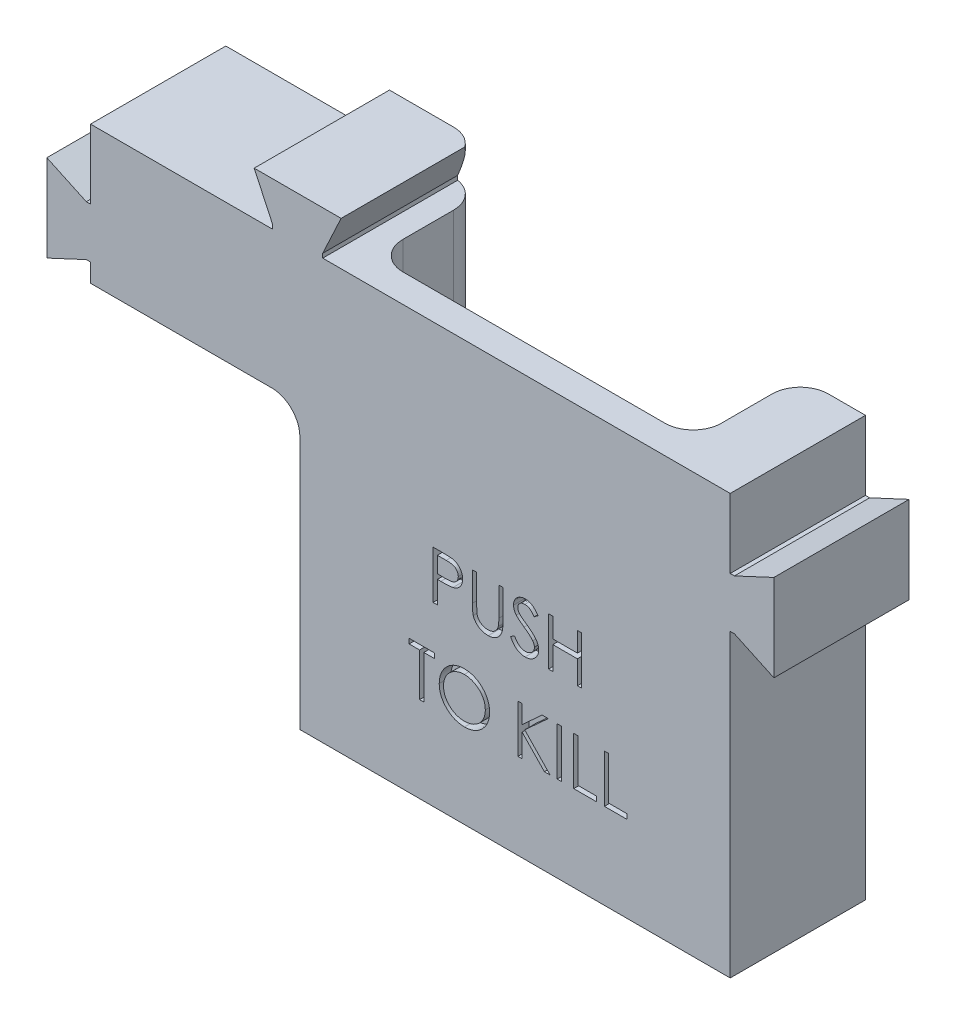
from build123d import *

# Parameters (mm, degrees)
BOSS_EXTRUDE1_DEPTH = 12.192
SKETCH2_W           = 28.702
SKETCH2_H           = 9.652
CUT_EXTRUDE1_DEPTH  = 70.581005453
FILLET1_R           = 2.54
BOSS_EXTRUDE2_DEPTH = 25.4
FILLET2_R           = 2.54
SKETCH4_W           = 0.387512821
SKETCH4_H           = 4.318
CUT_EXTRUDE2_DEPTH  = 1.016


with BuildPart() as part:
    # Sketch1 → Boss-Extrude1 (new body)
    with BuildSketch(Plane.XY):
        Polygon((4.926373889, 102.842156817), (21.33563188, 102.842156817), (21.33563188, 103.223156817), (19.677441848, 106.779156817), (27.51330593, 106.779156817), (25.855115898, 103.223156817), (25.855115898, 102.842156817), (62.584373889, 102.842156817), (62.584373889, 96.592898826), (62.965373889, 96.592898826), (66.521373889, 98.251088858), (66.521373889, 90.415224777), (62.965373889, 92.073414809), (62.584373889, 92.073414809), (62.584373889, 90.415224777), (4.926373889, 90.415224777), (4.926373889, 92.073414809), (4.545373889, 92.073414809), (0.989373889, 90.415224777), (0.989373889, 98.251088858), (4.545373889, 96.592898826), (4.926373889, 96.592898826), align=None)
    extrude(amount=BOSS_EXTRUDE1_DEPTH)

    # Sketch2 → Cut-Extrude1 (cut, through all)
    with BuildSketch(Plane.XZ.offset(-90.415224777)):
        with Locations((42.3545, 4.826)):
            Rectangle(SKETCH2_W, SKETCH2_H)
    extrude(amount=-CUT_EXTRUDE1_DEPTH, mode=Mode.SUBTRACT)

    # Fillet1
    fillet1_edges = [part.edges().sort_by_distance(p)[0] for p in [
        (56.7055, 96.628690797, 0),
        (28.0035, 96.628690797, 0),
        (28.0035, 96.628690797, 9.652),
        (56.7055, 96.628690797, 9.652),
    ]]
    fillet(fillet1_edges, radius=FILLET1_R)

    # Sketch3 → Boss-Extrude2 (add)
    with BuildSketch(Plane.XZ.offset(-90.415224777)):
        with BuildLine():
            Line((23.793902063, 12.192), (23.793902063, 0))
            Line((23.793902063, 0), (25.4635, 0))
            ThreePointArc((25.4635, 0), (27.259551224, 0.743948776), (28.0035, 2.54))
            Line((28.0035, 2.54), (28.0035, 7.112))
            ThreePointArc((28.0035, 7.112), (28.747448776, 8.908051224), (30.5435, 9.652))
            Line((30.5435, 9.652), (54.1655, 9.652))
            ThreePointArc((54.1655, 9.652), (55.961551224, 8.908051224), (56.7055, 7.112))
            Line((56.7055, 7.112), (56.7055, 2.54))
            ThreePointArc((56.7055, 2.54), (57.449448776, 0.743948776), (59.2455, 0))
            Line((59.2455, 0), (62.584373889, 0))
            Line((62.584373889, 0), (62.584373889, 12.192))
            Line((62.584373889, 12.192), (23.793902063, 12.192))
        make_face()
    extrude(amount=BOSS_EXTRUDE2_DEPTH)

    # Fillet2
    fillet2_edges = [part.edges().sort_by_distance(p)[0] for p in [
        (23.793902063, 90.415224777, 6.096),
    ]]
    fillet(fillet2_edges, radius=FILLET2_R)

    # Sketch4 → Cut-Extrude2 (cut)
    # profile 1 of 10: a face of its own
    with BuildSketch(Plane.XY.offset(12.192)):
        with BuildLine():
            Line((35.803091039, 85.260556175), (36.64991035, 85.260556175))
            add(Edge.make_bspline(
                [(36.64991035, 85.260556175), (36.708155119, 85.26049215), (36.819754684, 85.260369475), (36.979786001, 85.25665014), (37.12512955, 85.251682352), (37.255471934, 85.244795891), (37.371214195, 85.236657583), (37.4718326, 85.22524321), (37.55811803, 85.213325166), (37.609818615, 85.201208356), (37.633397129, 85.195682377)],
                knots=[0, 0, 0, 0, 1.415646017, 2.712440637, 3.8905458, 4.950247383, 5.884950622, 6.709939814, 7.411656543, 8, 8, 8, 8], degree=3))
            add(Edge.make_bspline(
                [(37.633397129, 85.195682377), (37.663245037, 85.187512783), (37.722237525, 85.171366101), (37.807241726, 85.139025856), (37.888116442, 85.100679345), (37.965139147, 85.056976324), (38.037363351, 85.006041734), (38.105866621, 84.949940282), (38.170044414, 84.887376695), (38.229535834, 84.819052685), (38.284170622, 84.746115238), (38.331211756, 84.667475538), (38.370600832, 84.584457296), (38.404383965, 84.497118256), (38.428698567, 84.404724994), (38.447015399, 84.30791949), (38.458641463, 84.20671212), (38.459754967, 84.137550261), (38.460321808, 84.102342633)],
                knots=[0, 0, 0, 0, 0.999701418, 1.975846123, 2.934577507, 3.890451536, 4.834027766, 5.787354733, 6.749476667, 7.726910423, 8.712836071, 9.690891519, 10.682875813, 11.679750201, 12.712814741, 13.765529915, 14.8625177, 16, 16, 16, 16], degree=3))
            add(Edge.make_bspline(
                [(38.460321808, 84.102342633), (38.45980189, 84.066839079), (38.458784636, 83.997373977), (38.446575448, 83.895749491), (38.4301298, 83.798633489), (38.404842294, 83.706241304), (38.371722403, 83.619121619), (38.332870208, 83.535943082), (38.286009384, 83.45812079), (38.232164134, 83.385372215), (38.172265338, 83.317629071), (38.106566428, 83.255382271), (38.035332638, 83.198996175), (37.958790353, 83.148344378), (37.876193368, 83.104601459), (37.788794391, 83.065422018), (37.695833753, 83.03251755), (37.631504789, 83.015208463), (37.59879777, 83.006407938)],
                knots=[0, 0, 0, 0, 1.121902311, 2.195077645, 3.232258892, 4.234102512, 5.217864754, 6.176164875, 7.132989551, 8.084763148, 9.034132444, 9.988522005, 10.94243251, 11.903244335, 12.886203696, 13.894208494, 14.929344452, 16, 16, 16, 16], degree=3))
            add(Edge.make_bspline(
                [(37.59879777, 83.006407938), (37.571745705, 83.000655151), (37.512459531, 82.988047586), (37.414820024, 82.973972809), (37.301138945, 82.961959392), (37.171571458, 82.952951875), (37.026233864, 82.945240706), (36.865047541, 82.939111497), (36.687696082, 82.935743638), (36.563990016, 82.93556994), (36.499403138, 82.935479252)],
                knots=[0, 0, 0, 0, 0.601384939, 1.31797006, 2.144135048, 3.087295005, 4.142315834, 5.309527816, 6.595305764, 8, 8, 8, 8], degree=3))
            Line((36.499403138, 82.935479252), (36.190603859, 82.935479252))
            Line((36.190603859, 82.935479252), (36.190603859, 80.942556175))
            Line((36.190603859, 80.942556175), (35.803091039, 80.942556175))
            Line((35.803091039, 80.942556175), (35.803091039, 85.260556175))
        make_face()
        with BuildLine():
            Line((36.190603859, 84.81768438), (36.190603859, 83.378351047))
            Line((36.190603859, 83.378351047), (36.946599853, 83.368836223))
            add(Edge.make_bspline(
                [(36.946599853, 83.368836223), (36.983512493, 83.368817145), (37.054771583, 83.368780316), (37.157708044, 83.373696944), (37.253208987, 83.379372686), (37.340981066, 83.387682891), (37.421063847, 83.399429403), (37.493590861, 83.411287541), (37.557999732, 83.428442786), (37.63337869, 83.451541704), (37.717374089, 83.490937428), (37.808752281, 83.548119949), (37.88619325, 83.621008663), (37.953206509, 83.702961627), (38.006386847, 83.794132039), (38.045317925, 83.891680516), (38.068192416, 83.994606646), (38.071259668, 84.065037098), (38.072808988, 84.100612665)],
                knots=[0, 0, 0, 0, 1.160613943, 2.240541288, 3.23993089, 4.169200891, 5.011653406, 5.7853311, 6.478053781, 7.106038997, 8.262395093, 9.384106736, 10.481365981, 11.59014053, 12.70357646, 13.786202915, 14.881775077, 16, 16, 16, 16], degree=3))
            add(Edge.make_bspline(
                [(38.072808988, 84.100612665), (38.071251243, 84.135327551), (38.068154638, 84.204336448), (38.045138633, 84.305474816), (38.006462537, 84.401995323), (37.952849516, 84.49202326), (37.88778203, 84.573681333), (37.812156155, 84.64461636), (37.726149908, 84.701640735), (37.646145719, 84.738446481), (37.575082313, 84.760918927), (37.51335717, 84.776642418), (37.443663818, 84.789196209), (37.365979568, 84.799361402), (37.280906537, 84.808063357), (37.187713839, 84.813967886), (37.086754504, 84.817424082), (37.016666492, 84.817595514), (36.980334228, 84.81768438)],
                knots=[0, 0, 0, 0, 1.120700087, 2.227813068, 3.331159281, 4.466773991, 5.599788987, 6.693661531, 7.80175334, 8.91857717, 9.525282508, 10.207424825, 10.974604443, 11.810962634, 12.737642355, 13.736264703, 14.826523623, 16, 16, 16, 16], degree=3))
            Line((36.980334228, 84.81768438), (36.190603859, 84.81768438))
        make_face(mode=Mode.SUBTRACT)
    # profile 2 of 10: a face of its own
    with BuildSketch(Plane.XY.offset(12.192)):
        with BuildLine():
            Line((39.346065398, 85.260556175), (39.733578218, 85.260556175))
            Line((39.733578218, 85.260556175), (39.733578218, 82.673389108))
            add(Edge.make_bspline(
                [(39.733578218, 82.673389108), (39.73352055, 82.63677156), (39.733411113, 82.567283453), (39.734142106, 82.468378675), (39.736189293, 82.380448824), (39.737479955, 82.303154962), (39.740351219, 82.236851767), (39.742692867, 82.181180026), (39.745703817, 82.13640335), (39.749322446, 82.110272139), (39.750877898, 82.099039749)],
                knots=[0, 0, 0, 0, 1.528628734, 2.90083645, 4.128790002, 5.200304208, 6.127813768, 6.898992206, 7.526736466, 8, 8, 8, 8], degree=3))
            add(Edge.make_bspline(
                [(39.750877898, 82.099039749), (39.757265403, 82.058516228), (39.7696805, 81.979752541), (39.801320802, 81.867597695), (39.845509365, 81.766517684), (39.897871953, 81.673358325), (39.966876815, 81.590712595), (40.049540033, 81.514578047), (40.149690206, 81.447992261), (40.261046005, 81.387107459), (40.381068192, 81.338172081), (40.503713291, 81.301168839), (40.627137744, 81.278617899), (40.709767196, 81.276006694), (40.750799372, 81.274710021)],
                knots=[0, 0, 0, 0, 1.035780045, 2.013197591, 2.933192213, 3.817615948, 4.702609284, 5.640816605, 6.646850145, 7.73207398, 8.84249596, 9.914020372, 10.964143139, 12, 12, 12, 12], degree=3))
            add(Edge.make_bspline(
                [(40.750799372, 81.274710021), (40.78602653, 81.276034846), (40.856277382, 81.278676843), (40.960657544, 81.29503766), (41.062315735, 81.324524129), (41.161753945, 81.362571579), (41.254962274, 81.412842465), (41.341992726, 81.470914432), (41.419672232, 81.539028878), (41.490558984, 81.614409246), (41.552287799, 81.699461262), (41.605795396, 81.792332976), (41.649624243, 81.894422028), (41.671267941, 81.966167969), (41.682387113, 82.003026528)],
                knots=[0, 0, 0, 0, 0.994687771, 1.983630487, 2.973142513, 3.978332533, 4.983357753, 5.956394766, 6.925816176, 7.893390482, 8.871859704, 9.88551698, 10.913711441, 12, 12, 12, 12], degree=3))
            add(Edge.make_bspline(
                [(41.682387113, 82.003026528), (41.68608841, 82.01826114), (41.694336392, 82.052209996), (41.702043461, 82.109603977), (41.710070654, 82.17732177), (41.715640344, 82.25584992), (41.721070192, 82.344925292), (41.724318652, 82.445011915), (41.725820123, 82.555746359), (41.726267567, 82.633022721), (41.726501295, 82.673389108)],
                knots=[0, 0, 0, 0, 0.558680831, 1.244966039, 2.062412453, 2.990489873, 4.051219941, 5.244515665, 6.560634259, 8, 8, 8, 8], degree=3))
            Line((41.726501295, 82.673389108), (41.726501295, 85.260556175))
            Line((41.726501295, 85.260556175), (42.114014116, 85.260556175))
            Line((42.114014116, 85.260556175), (42.114014116, 82.652629492))
            add(Edge.make_bspline(
                [(42.114014116, 82.652629492), (42.113700604, 82.605626978), (42.113088766, 82.513898713), (42.107783084, 82.379483865), (42.099323505, 82.251975816), (42.087371172, 82.131357425), (42.071533978, 82.018060311), (42.053922435, 81.9110914), (42.031494085, 81.811218536), (42.005298135, 81.717662999), (41.975351512, 81.6286067), (41.936562118, 81.544086643), (41.892858406, 81.461533393), (41.841024329, 81.38219556), (41.782778972, 81.305721864), (41.716834869, 81.232576085), (41.645373005, 81.161589342), (41.567205411, 81.094582536), (41.48362062, 81.03313286), (41.394867266, 80.979098924), (41.301627126, 80.933422358), (41.204142569, 80.895823775), (41.102371993, 80.867553707), (40.996312833, 80.846487843), (40.88572368, 80.83451798), (40.810510713, 80.83273905), (40.772423972, 80.831838226)],
                knots=[0, 0, 0, 0, 1.316592851, 2.569410997, 3.76748051, 4.895814652, 5.963796859, 6.97159953, 7.931736103, 8.829262218, 9.692595152, 10.560224239, 11.431080259, 12.30701507, 13.211635791, 14.121146779, 15.063487852, 16.031507147, 17.00238618, 17.966455255, 18.938106653, 19.907068911, 20.888905087, 21.893141452, 22.933117798, 24, 24, 24, 24], degree=3))
            add(Edge.make_bspline(
                [(40.772423972, 80.831838226), (40.730885919, 80.832806402), (40.649388408, 80.83470596), (40.529301043, 80.845590713), (40.414177986, 80.866093064), (40.302803347, 80.892198389), (40.196693436, 80.928202782), (40.094426609, 80.970270126), (39.997754385, 81.0219347), (39.905108452, 81.079417635), (39.818964653, 81.14409466), (39.739886771, 81.214589309), (39.667744254, 81.289772323), (39.603753102, 81.370457689), (39.546853108, 81.45601788), (39.497837376, 81.546694942), (39.45575138, 81.642453768), (39.434029906, 81.709016602), (39.423048972, 81.742666351)],
                knots=[0, 0, 0, 0, 1.13879206, 2.234305948, 3.301075583, 4.341971843, 5.366689343, 6.369221514, 7.369726634, 8.367512178, 9.355451585, 10.318319045, 11.268648973, 12.207971039, 13.137398894, 14.081662264, 15.030215811, 16, 16, 16, 16], degree=3))
            add(Edge.make_bspline(
                [(39.423048972, 81.742666351), (39.416661838, 81.765653625), (39.402808002, 81.815513532), (39.38797222, 81.898032349), (39.375500502, 81.993046753), (39.363773359, 82.100563248), (39.356853507, 82.220665169), (39.350786793, 82.353300455), (39.346022659, 82.498629483), (39.346050753, 82.599861311), (39.346065398, 82.652629492)],
                knots=[0, 0, 0, 0, 0.625038921, 1.35572334, 2.194682327, 3.136881307, 4.189498639, 5.346923369, 6.617055217, 8, 8, 8, 8], degree=3))
            Line((39.346065398, 82.652629492), (39.346065398, 85.260556175))
        make_face()
    # profile 3 of 10: a face of its own
    with BuildSketch(Plane.XY.offset(12.192)):
        with BuildLine():
            Line((42.778321808, 81.775535742), (43.143345045, 81.994376688))
            add(Edge.make_bspline(
                [(43.143345045, 81.994376688), (43.177294688, 81.937546398), (43.242340892, 81.828661756), (43.350847741, 81.681531408), (43.463279715, 81.556479467), (43.580469413, 81.454233412), (43.701701517, 81.373734929), (43.827767444, 81.316734575), (43.958242366, 81.281183895), (44.047037497, 81.276865788), (44.091367481, 81.274710021)],
                knots=[0, 0, 0, 0, 1.272034388, 2.437168799, 3.508375237, 4.49857839, 5.41946034, 6.295179144, 7.148887113, 8, 8, 8, 8], degree=3))
            add(Edge.make_bspline(
                [(44.091367481, 81.274710021), (44.129226299, 81.275764443), (44.204281495, 81.277854836), (44.314775714, 81.297940694), (44.422086406, 81.328798515), (44.524001863, 81.37299131), (44.619115824, 81.426458619), (44.702523169, 81.491038846), (44.774628974, 81.563342159), (44.833611762, 81.644005674), (44.878864445, 81.730756945), (44.913645403, 81.819801447), (44.932946954, 81.912537984), (44.935854514, 81.974976835), (44.937321808, 82.006486463)],
                knots=[0, 0, 0, 0, 1.095163259, 2.171163733, 3.241058638, 4.321873601, 5.38011039, 6.391990106, 7.366004449, 8.327778327, 9.272591725, 10.192022065, 11.087607919, 12, 12, 12, 12], degree=3))
            add(Edge.make_bspline(
                [(44.937321808, 82.006486463), (44.93550293, 82.042437946), (44.931805416, 82.115522057), (44.900553608, 82.223348257), (44.851391023, 82.330055376), (44.806036424, 82.396060652), (44.782489677, 82.430328611)],
                knots=[0, 0, 0, 0, 0.938893495, 1.908633276, 2.914225137, 4, 4, 4, 4], degree=3))
            add(Edge.make_bspline(
                [(44.782489677, 82.430328611), (44.763156616, 82.455060664), (44.722569274, 82.506982514), (44.652793463, 82.584268836), (44.570916639, 82.663989503), (44.479740768, 82.749188648), (44.375944574, 82.835903707), (44.262779029, 82.928269771), (44.137354874, 83.022774231), (44.049391667, 83.086153299), (44.0040041, 83.118855854)],
                knots=[0, 0, 0, 0, 0.722233717, 1.516239348, 2.393582979, 3.351407094, 4.387010283, 5.505090956, 6.712668013, 8, 8, 8, 8], degree=3))
            add(Edge.make_bspline(
                [(44.0040041, 83.118855854), (43.95857381, 83.151214438), (43.871714554, 83.213081585), (43.750244795, 83.304899887), (43.641623083, 83.388846581), (43.546332205, 83.465711931), (43.464414074, 83.535506362), (43.395223168, 83.597559648), (43.340522057, 83.653549995), (43.310104115, 83.689872199), (43.296447209, 83.706179973)],
                knots=[0, 0, 0, 0, 1.452282411, 2.77665338, 3.964542531, 5.026858415, 5.96415736, 6.766646006, 7.446254459, 8, 8, 8, 8], degree=3))
            add(Edge.make_bspline(
                [(43.296447209, 83.706179973), (43.277358509, 83.731595767), (43.239818018, 83.781579335), (43.190264643, 83.859704117), (43.148146671, 83.939677506), (43.115129599, 84.021714404), (43.087326344, 84.104663096), (43.068625788, 84.189605861), (43.056916116, 84.276161551), (43.055716963, 84.334409521), (43.05511668, 84.363567794)],
                knots=[0, 0, 0, 0, 1.068054152, 2.10047183, 3.106115577, 4.101338837, 5.06977816, 6.043150881, 7.020423561, 8, 8, 8, 8], degree=3))
            add(Edge.make_bspline(
                [(43.05511668, 84.363567794), (43.056726935, 84.409251955), (43.059913027, 84.499643812), (43.086857985, 84.631689277), (43.129387686, 84.75775812), (43.188969779, 84.876602228), (43.265777565, 84.985127116), (43.354661713, 85.084581126), (43.460528569, 85.168188194), (43.576686006, 85.241238957), (43.703828124, 85.298416587), (43.837058044, 85.341548447), (43.976587518, 85.365987412), (44.071093899, 85.369494571), (44.119046968, 85.371274124)],
                knots=[0, 0, 0, 0, 1.005424448, 1.989358655, 2.955360095, 3.929531133, 4.905563448, 5.876582895, 6.856512386, 7.866279853, 8.892233794, 9.918561126, 10.94386622, 12, 12, 12, 12], degree=3))
            add(Edge.make_bspline(
                [(44.119046968, 85.371274124), (44.169930404, 85.369519101), (44.271121318, 85.366028922), (44.419967978, 85.335682597), (44.563277114, 85.285469596), (44.678559404, 85.228485989), (44.768784337, 85.171573003), (44.837591954, 85.119732545), (44.90731834, 85.060051483), (44.978525929, 84.992370847), (45.050008148, 84.916069627), (45.122826225, 84.831670382), (45.19715044, 84.739688894), (45.244964098, 84.674025067), (45.269475654, 84.640362665)],
                knots=[0, 0, 0, 0, 1.286793592, 2.559021753, 3.825965368, 5.121522368, 5.803751409, 6.523245864, 7.299691795, 8.125521123, 9.008227632, 9.944561021, 10.946284179, 12, 12, 12, 12], degree=3))
            Line((45.269475654, 84.640362665), (44.919157145, 84.374812585))
            add(Edge.make_bspline(
                [(44.919157145, 84.374812585), (44.898003963, 84.402063718), (44.85726788, 84.454543029), (44.795422416, 84.528037012), (44.737131084, 84.5951714), (44.679701191, 84.653483064), (44.626165848, 84.706165295), (44.574205452, 84.75126959), (44.524567758, 84.789237882), (44.46199758, 84.829757451), (44.383388121, 84.869922874), (44.284710056, 84.903910565), (44.181588474, 84.924334782), (44.111353575, 84.927035244), (44.07579777, 84.928402329)],
                knots=[0, 0, 0, 0, 1.181633172, 2.275549214, 3.290209073, 4.226197932, 5.078386478, 5.862611352, 6.581680152, 7.217281963, 8.414376989, 9.595101626, 10.782541182, 12, 12, 12, 12], degree=3))
            add(Edge.make_bspline(
                [(44.07579777, 84.928402329), (44.031190951, 84.926907437), (43.945170905, 84.92402468), (43.823045236, 84.892540309), (43.713128788, 84.842967374), (43.618684795, 84.773490781), (43.540051576, 84.691176139), (43.483170613, 84.596452969), (43.448934838, 84.491855708), (43.444757137, 84.418891802), (43.4426295, 84.381732457)],
                knots=[0, 0, 0, 0, 1.14458467, 2.207223713, 3.21896685, 4.227309161, 5.202851033, 6.127160689, 7.046193047, 8, 8, 8, 8], degree=3))
            add(Edge.make_bspline(
                [(43.4426295, 84.381732457), (43.443114506, 84.35859849), (43.444085311, 84.312292728), (43.457625076, 84.243881516), (43.47501962, 84.175643127), (43.502584044, 84.107884352), (43.540638335, 84.039420168), (43.590610149, 83.969071636), (43.653546001, 83.896218699), (43.70175587, 83.848834973), (43.727209228, 83.823817794)],
                knots=[0, 0, 0, 0, 0.858281714, 1.717966888, 2.583508476, 3.4729293, 4.427298488, 5.488583878, 6.674047936, 8, 8, 8, 8], degree=3))
            add(Edge.make_bspline(
                [(43.727209228, 83.823817794), (43.736661173, 83.815382857), (43.759116829, 83.795343379), (43.800169814, 83.762536102), (43.854382672, 83.722066854), (43.920339754, 83.671993702), (43.999257202, 83.613908629), (44.091143694, 83.548554327), (44.194974979, 83.473809181), (44.26865476, 83.421552078), (44.307613475, 83.393920758)],
                knots=[0, 0, 0, 0, 0.420754252, 0.999615792, 1.744751191, 2.668019286, 3.750313428, 4.999500688, 6.413464383, 8, 8, 8, 8], degree=3))
            add(Edge.make_bspline(
                [(44.307613475, 83.393920758), (44.354477239, 83.359819218), (44.445222422, 83.293786312), (44.574339974, 83.194576339), (44.69141182, 83.097547463), (44.796848996, 83.003319318), (44.891693136, 82.912606659), (44.974892015, 82.824318142), (45.047293377, 82.739086284), (45.125238482, 82.629813032), (45.204884386, 82.495608254), (45.273283366, 82.331180987), (45.316411978, 82.166114555), (45.322051922, 82.055170532), (45.324834629, 82.000431576)],
                knots=[0, 0, 0, 0, 1.163667725, 2.253281268, 3.268753668, 4.215851969, 5.092017293, 5.902905408, 6.650798638, 7.335211899, 8.59617414, 9.77448103, 10.901945474, 12, 12, 12, 12], degree=3))
            add(Edge.make_bspline(
                [(45.324834629, 82.000431576), (45.324023908, 81.961719638), (45.32241821, 81.885047523), (45.303960717, 81.772464831), (45.276918113, 81.663119661), (45.236159606, 81.558363609), (45.186412349, 81.456280213), (45.123287818, 81.359547266), (45.05011908, 81.266023829), (44.966184853, 81.178203739), (44.87433988, 81.097585204), (44.777266681, 81.02587055), (44.674806373, 80.966074487), (44.567514786, 80.917280048), (44.455367275, 80.879116926), (44.338401557, 80.851465849), (44.216424829, 80.834495232), (44.133518635, 80.832733782), (44.091367481, 80.831838226)],
                knots=[0, 0, 0, 0, 0.983748083, 1.948392443, 2.894712957, 3.844097841, 4.80183111, 5.778335162, 6.776009319, 7.81870978, 8.863265674, 9.881300176, 10.883814829, 11.87499822, 12.874611388, 13.892143829, 14.928324115, 16, 16, 16, 16], degree=3))
            add(Edge.make_bspline(
                [(44.091367481, 80.831838226), (44.058753821, 80.832468878), (43.993937236, 80.83372224), (43.898065938, 80.844802574), (43.804131439, 80.860479509), (43.713312448, 80.885368548), (43.624438864, 80.915566144), (43.537897218, 80.952748235), (43.45364557, 80.997306543), (43.371211763, 81.048252804), (43.290805453, 81.10754233), (43.213180807, 81.176597633), (43.135790914, 81.253514173), (43.060920006, 81.340380691), (42.987053653, 81.435793788), (42.915648232, 81.540646158), (42.845225702, 81.654366676), (42.801039647, 81.734391659), (42.778321808, 81.775535742)],
                knots=[0, 0, 0, 0, 0.915332311, 1.819136955, 2.706846663, 3.586547465, 4.459518054, 5.340707479, 6.227863349, 7.133153174, 8.059268498, 9.028702269, 10.047606654, 11.120612155, 12.245963614, 13.433783089, 14.680604001, 16, 16, 16, 16], degree=3))
        make_face()
    # profile 4 of 10: a face of its own
    with BuildSketch(Plane.XY.offset(12.192)):
        Polygon((46.210578218, 85.260556175), (46.598091039, 85.260556175), (46.598091039, 83.489068996), (48.812450013, 83.489068996), (48.812450013, 85.260556175), (49.199962834, 85.260556175), (49.199962834, 80.942556175), (48.812450013, 80.942556175), (48.812450013, 83.046197201), (46.598091039, 83.046197201), (46.598091039, 80.942556175), (46.210578218, 80.942556175), align=None)
    # profile 5 of 10: a face of its own
    with BuildSketch(Plane.XY.offset(12.192)):
        Polygon((33.644091039, 76.621017713), (33.644091039, 77.063889508), (35.913808988, 77.063889508), (35.913808988, 76.621017713), (34.972706424, 76.621017713), (34.972706424, 72.745889508), (34.585193603, 72.745889508), (34.585193603, 76.621017713), align=None)
    # profile 6 of 10: a face of its own
    with BuildSketch(Plane.XY.offset(12.192)):
        with BuildLine():
            add(Edge.make_bspline(
                [(38.598719244, 77.174607457), (38.67867393, 77.17258234), (38.83571153, 77.168604845), (39.066508504, 77.138157882), (39.286843824, 77.085483969), (39.498512356, 77.015331296), (39.698982262, 76.921748657), (39.889762473, 76.808635379), (40.070399062, 76.674806423), (40.238457326, 76.521296308), (40.392248387, 76.354271807), (40.527742152, 76.176027345), (40.641296044, 75.987640651), (40.73454731, 75.789677832), (40.807704852, 75.582586592), (40.85818726, 75.365262882), (40.89043427, 75.1391148), (40.894204226, 74.984867371), (40.89611668, 74.906619476)],
                knots=[0, 0, 0, 0, 1.065120563, 2.091984664, 3.0946048, 4.079830382, 5.057816894, 6.036188127, 7.030412546, 8.04752943, 9.064399622, 10.05169764, 11.02544977, 11.989514704, 12.962713494, 13.945757189, 14.957906945, 16, 16, 16, 16], degree=3))
            add(Edge.make_bspline(
                [(40.89611668, 74.906619476), (40.894204506, 74.828947975), (40.89043539, 74.675848449), (40.858150595, 74.45113548), (40.807517727, 74.235123586), (40.735226676, 74.028173378), (40.642419929, 73.830066543), (40.528109921, 73.641324353), (40.39346085, 73.46188493), (40.240225083, 73.293714048), (40.073178884, 73.139502882), (39.894006229, 73.005128109), (39.706736641, 72.889499318), (39.508960264, 72.797237631), (39.303300047, 72.723496159), (39.087915341, 72.673219057), (38.863815393, 72.640788356), (38.710993966, 72.63706437), (38.633318603, 72.63517156)],
                knots=[0, 0, 0, 0, 1.043624062, 2.057103931, 3.04512605, 4.022047818, 4.998200453, 5.980619268, 6.982898556, 8.009068085, 9.034988726, 10.034168286, 11.015286542, 11.987931943, 12.962482838, 13.94673481, 14.956375938, 16, 16, 16, 16], degree=3))
            add(Edge.make_bspline(
                [(38.633318603, 72.63517156), (38.555071115, 72.63708306), (38.400824486, 72.640851137), (38.174392223, 72.67315151), (37.956915853, 72.723661382), (37.74901729, 72.795845309), (37.550580603, 72.889135367), (37.361217695, 73.002889226), (37.181688644, 73.137866379), (37.013481884, 73.291052456), (36.859577016, 73.457815531), (36.72539902, 73.63649962), (36.611619581, 73.823599124), (36.518642761, 74.019633269), (36.445033865, 74.223654381), (36.394815749, 74.437023388), (36.362324709, 74.658523841), (36.358580575, 74.809336651), (36.356680783, 74.885859861)],
                knots=[0, 0, 0, 0, 1.053102029, 2.075944431, 3.073151272, 4.055350789, 5.033113405, 6.020478099, 7.024410459, 8.052272461, 9.079885166, 10.07527673, 11.055994387, 12.023226415, 12.992069828, 13.970394897, 14.97016774, 16, 16, 16, 16], degree=3))
            add(Edge.make_bspline(
                [(36.356680783, 74.885859861), (36.35734037, 74.93722268), (36.358651224, 75.039300352), (36.374432518, 75.190882632), (36.397332354, 75.340027163), (36.430151513, 75.486309836), (36.47307449, 75.629372559), (36.523720962, 75.770201986), (36.585579206, 75.907370934), (36.655506931, 76.04152921), (36.733553927, 76.170585478), (36.819760638, 76.292574632), (36.911099129, 76.40852033), (37.011231568, 76.515417977), (37.116857799, 76.616377328), (37.229691307, 76.709846874), (37.349043596, 76.796669457), (37.475428223, 76.874912037), (37.605730998, 76.945676821), (37.740053834, 77.006402522), (37.876572427, 77.058522091), (38.01592619, 77.100765487), (38.157745067, 77.134115296), (38.302338583, 77.156824711), (38.449591545, 77.172646255), (38.548796138, 77.17395091), (38.598719244, 77.174607457)],
                knots=[0, 0, 0, 0, 1.037015668, 2.060948919, 3.074880161, 4.083647147, 5.086022904, 6.090072063, 7.104153813, 8.122640571, 9.144368836, 10.147691507, 11.138137339, 12.123020368, 13.103399296, 14.087645067, 15.080126199, 16.082011238, 17.087798457, 18.072939717, 19.057185487, 20.037253025, 21.01195951, 21.997135196, 22.992090687, 24, 24, 24, 24], degree=3))
        make_face()
        with BuildLine():
            add(Edge.make_bspline(
                [(38.617748892, 76.731735662), (38.576771524, 76.731236143), (38.495208534, 76.730241881), (38.373953498, 76.717145121), (38.254293163, 76.698479161), (38.136202819, 76.67185373), (38.020176568, 76.63557753), (37.905132907, 76.593827519), (37.792120911, 76.54297247), (37.681513666, 76.485515059), (37.574285296, 76.421918419), (37.473105054, 76.351631537), (37.377711004, 76.276302726), (37.288336711, 76.195756188), (37.205244608, 76.109581737), (37.126799253, 76.019085788), (37.056144952, 75.921681713), (36.991392746, 75.820010816), (36.933447851, 75.714205528), (36.881921336, 75.605379761), (36.83977271, 75.492645804), (36.805398499, 75.377226703), (36.776899932, 75.259305257), (36.758845851, 75.137986915), (36.745605185, 75.013881289), (36.744667753, 74.930011104), (36.744193603, 74.887589829)],
                knots=[0, 0, 0, 0, 1.008559885, 2.007477868, 2.99961109, 3.989939068, 4.984837346, 5.991145699, 7.001802488, 8.033829008, 9.059044045, 10.069351652, 11.065060232, 12.050310815, 13.029377138, 14.011219647, 14.996725999, 15.989392538, 16.977580475, 17.965360261, 18.951710183, 19.937753436, 20.929683414, 21.935841486, 22.955955122, 24, 24, 24, 24], degree=3))
            add(Edge.make_bspline(
                [(36.744193603, 74.887589829), (36.745766418, 74.825210495), (36.748860633, 74.702491047), (36.775950001, 74.522654805), (36.817676654, 74.349825885), (36.879186399, 74.184949953), (36.956109243, 74.026609777), (37.051138418, 73.876210007), (37.163726056, 73.733709993), (37.291617229, 73.600104573), (37.431425071, 73.478157092), (37.579881279, 73.371115836), (37.735395416, 73.280548562), (37.898373024, 73.206766189), (38.067944016, 73.148300793), (38.245201064, 73.108231442), (38.428963374, 73.081860237), (38.554223193, 73.079327723), (38.617748892, 73.078043354)],
                knots=[0, 0, 0, 0, 1.032063989, 2.030389145, 3.003944642, 3.970395727, 4.937377036, 5.913328081, 6.909231446, 7.93887556, 8.970685674, 9.976071282, 10.964166581, 11.944589148, 12.933237628, 13.927779006, 14.949070134, 16, 16, 16, 16], degree=3))
            add(Edge.make_bspline(
                [(38.617748892, 73.078043354), (38.660447128, 73.078629991), (38.745130555, 73.079793467), (38.87108726, 73.091512121), (38.99477478, 73.110303896), (39.116019631, 73.137360059), (39.234684207, 73.171222069), (39.351263795, 73.211450689), (39.464516657, 73.261639671), (39.575871509, 73.317092601), (39.682459786, 73.380308316), (39.784211029, 73.448209667), (39.878560538, 73.523427526), (39.967867969, 73.60277733), (40.051301215, 73.687859014), (40.12829607, 73.778561962), (40.198593274, 73.875458693), (40.263320891, 73.976975373), (40.321062745, 74.083070179), (40.371372502, 74.192290507), (40.414054225, 74.304367416), (40.44851002, 74.419462561), (40.475510427, 74.537357345), (40.494114739, 74.658209626), (40.507128499, 74.781777637), (40.508109397, 74.8653542), (40.508603859, 74.90748446)],
                knots=[0, 0, 0, 0, 1.047197238, 2.076906641, 3.100256066, 4.114471768, 5.12198147, 6.126382909, 7.136867548, 8.15857795, 9.17633901, 10.174870724, 11.156907918, 12.133735059, 13.104061851, 14.077631395, 15.04955518, 16.038496417, 17.029181396, 18.010275684, 18.986308667, 19.968651475, 20.955262928, 21.950658345, 22.966943676, 24, 24, 24, 24], degree=3))
            add(Edge.make_bspline(
                [(40.508603859, 74.90748446), (40.508109001, 74.949326502), (40.507127357, 75.032327901), (40.494120955, 75.155034133), (40.475490771, 75.275016809), (40.448641808, 75.391804895), (40.414035932, 75.505428161), (40.371365049, 75.615779892), (40.321047642, 75.723271191), (40.263299667, 75.827636384), (40.198386774, 75.927782817), (40.127455304, 76.023522022), (40.049280569, 76.11305605), (39.966096119, 76.198595253), (39.875824153, 76.278315266), (39.778873586, 76.352242536), (39.676421415, 76.422161164), (39.567944328, 76.4852355), (39.455992216, 76.543484373), (39.341116196, 76.593389354), (39.224617667, 76.635794729), (39.106792879, 76.671963487), (38.986650108, 76.69837488), (38.865001155, 76.717161943), (38.742014327, 76.730237323), (38.659302149, 76.731234631), (38.617748892, 76.731735662)],
                knots=[0, 0, 0, 0, 1.02996197, 2.043119294, 3.035359645, 4.018872909, 4.991431989, 5.957985074, 6.929999688, 7.912076566, 8.892894881, 9.867085534, 10.843653904, 11.817741046, 12.803660682, 13.806313499, 14.818574707, 15.856120519, 16.894564902, 17.924820532, 18.937903209, 19.946497019, 20.957711757, 21.963978472, 22.977135795, 24, 24, 24, 24], degree=3))
        make_face(mode=Mode.SUBTRACT)
    # profile 7 of 10: a face of its own
    with BuildSketch(Plane.XY.offset(12.192)):
        Polygon((43.4426295, 77.063889508), (43.830142321, 77.063889508), (43.830142321, 75.419554973), (45.630173972, 77.063889508), (46.182898731, 77.063889508), (44.061093042, 75.126325406), (46.348975654, 72.745889508), (45.832580222, 72.745889508), (43.830142321, 74.829635903), (43.830142321, 72.745889508), (43.4426295, 72.745889508), align=None)
    # profile 8 of 10: a face of its own
    with BuildSketch(Plane.XY.offset(12.192)):
        with Locations((47.17936027, 74.904889508)):
            Rectangle(SKETCH4_W, SKETCH4_H)
    # profile 9 of 10: a face of its own
    with BuildSketch(Plane.XY.offset(12.192)):
        Polygon((48.480296167, 77.063889508), (48.867808988, 77.063889508), (48.867808988, 73.188761303), (50.528578218, 73.188761303), (50.528578218, 72.745889508), (48.480296167, 72.745889508), align=None)
    # profile 10 of 10: a face of its own
    with BuildSketch(Plane.XY.offset(12.192)):
        Polygon((51.248244885, 77.063889508), (51.635757706, 77.063889508), (51.635757706, 73.188761303), (53.296526936, 73.188761303), (53.296526936, 72.745889508), (51.248244885, 72.745889508), align=None)
    extrude(amount=-CUT_EXTRUDE2_DEPTH, mode=Mode.SUBTRACT)


solid = part.part
